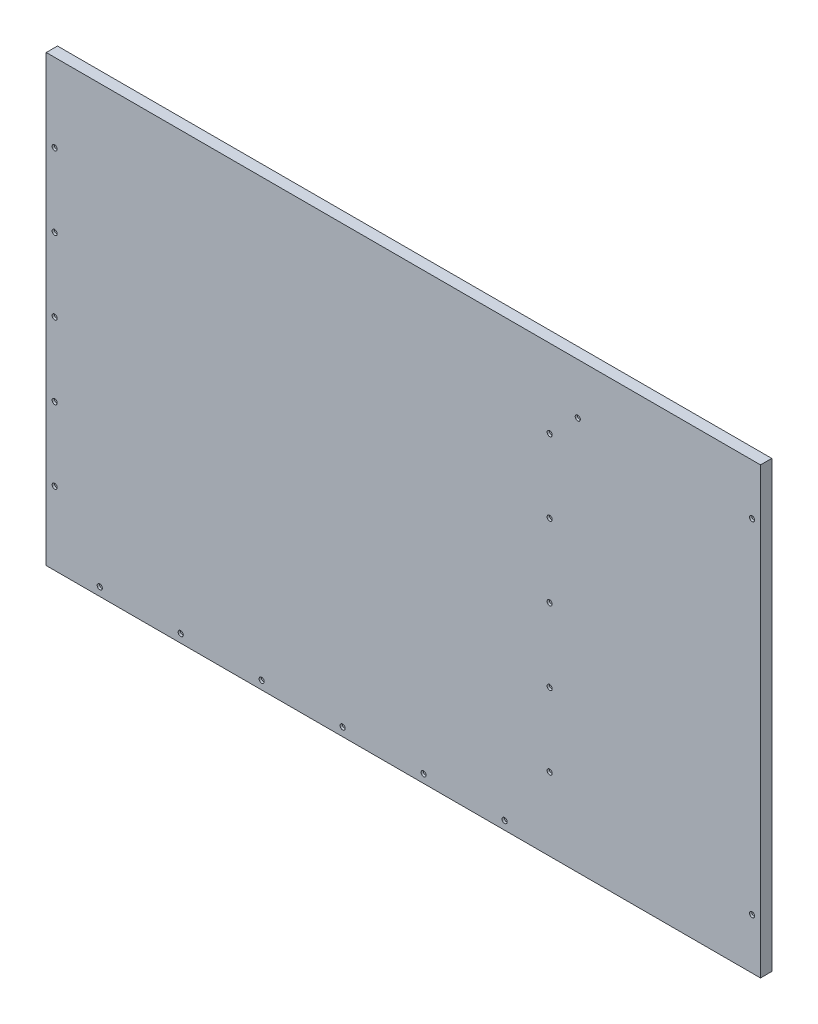
from build123d import *

# Parameters (mm, degrees)
SKETCH1_W                    = 806.6532
SKETCH1_H                    = 501.8532
BOSS_EXTRUDE1_DEPTH          = 12.7
SKETCH2_R                    = 2.8956
SIDEBARHOLEMASTER_DEPTH      = 476.18185451
SKETCH3_R                    = 6.35
COUNTERSINK_DEPTH            = 10.16
LPATTERN1_COUNT              = 5
LPATTERN1_PITCH              = 82.739099952
SKETCH4_R                    = 2.8956
REARBARMOUNT_DEPTH           = 476.18185451
SKETCH5_R                    = 6.35
REARBARCOUNTERSINK_DEPTH     = 10.16
LPATTERN2_COUNT              = 6
LPATTERN2_PITCH              = 91.44
SKETCH6_R                    = 2.8956
EBFORWARDMOUNTHOLE_DEPTH     = 476.18185451
SKETCH7_R                    = 6.35
EB_MOUNTS_COUNTERSINKS_DEPTH = 10.16


with BuildPart() as part:
    # Sketch1 → Boss-Extrude1 (new body)
    with BuildSketch(Plane.XY):
        Rectangle(SKETCH1_W, SKETCH1_H)
    extrude(amount=BOSS_EXTRUDE1_DEPTH)

    # Sketch2 → SideBarHoleMaster (cut, through all)
    with BuildSketch(Plane.XY.offset(12.7)):
        with Locations((-393.8016, -168.4782)):
            Circle(SKETCH2_R)
        with Locations((165.2016, -168.4782)):
            Circle(SKETCH2_R)
    sidebarholemaster = extrude(amount=-SIDEBARHOLEMASTER_DEPTH, mode=Mode.SUBTRACT)

    # Sketch3 → Countersink (cut)
    with BuildSketch(Plane(origin=(0, 0, 0), x_dir=(-1, 0, 0), z_dir=(0, 0, -1))):
        with Locations((-165.2016, -168.4782)):
            Circle(SKETCH3_R)
        with Locations((393.8016, -168.4782)):
            Circle(SKETCH3_R)
    countersink = extrude(amount=-COUNTERSINK_DEPTH, mode=Mode.SUBTRACT)

    # LPattern1: SideBarHoleMaster, Countersink ×5
    with Locations(*[(0, i * LPATTERN1_PITCH, 0) for i in range(1, LPATTERN1_COUNT)]):
        add(sidebarholemaster, mode=Mode.SUBTRACT)
        add(countersink, mode=Mode.SUBTRACT)

    # Sketch4 → RearBarMount (cut, through all)
    with BuildSketch(Plane.XY.offset(12.7)):
        with Locations((-342.9, -241.4016)):
            Circle(SKETCH4_R)
    rearbarmount = extrude(amount=-REARBARMOUNT_DEPTH, mode=Mode.SUBTRACT)

    # Sketch5 → RearBarCounterSink (cut)
    with BuildSketch(Plane(origin=(0, 0, 0), x_dir=(-1, 0, 0), z_dir=(0, 0, -1))):
        with Locations((342.9, -241.4016)):
            Circle(SKETCH5_R)
    rearbarcountersink = extrude(amount=-REARBARCOUNTERSINK_DEPTH, mode=Mode.SUBTRACT)

    # LPattern2: RearBarMount, RearBarCounterSink ×6
    with Locations(*[(i * LPATTERN2_PITCH, 0, 0) for i in range(1, LPATTERN2_COUNT)]):
        add(rearbarmount, mode=Mode.SUBTRACT)
        add(rearbarcountersink, mode=Mode.SUBTRACT)

    # Sketch6 → EBForwardMountHole (cut, through all)
    with BuildSketch(Plane.XY.offset(12.7)):
        with Locations((393.8016, 193.5734)):
            Circle(SKETCH6_R)
        with Locations((393.8016, -193.7766)):
            Circle(SKETCH6_R)
        with Locations((196.9516, 193.5734)):
            Circle(SKETCH6_R)
    extrude(amount=-EBFORWARDMOUNTHOLE_DEPTH, mode=Mode.SUBTRACT)

    # Sketch7 → EB-Mounts-Countersinks (cut)
    with BuildSketch(Plane(origin=(0, 0, 0), x_dir=(-1, 0, 0), z_dir=(0, 0, -1))):
        with Locations((-393.8016, 193.5734)):
            Circle(SKETCH7_R)
        with Locations((-393.8016, -193.7766)):
            Circle(SKETCH7_R)
        with Locations((-196.9516, 193.5734)):
            Circle(SKETCH7_R)
    extrude(amount=-EB_MOUNTS_COUNTERSINKS_DEPTH, mode=Mode.SUBTRACT)


solid = part.part
